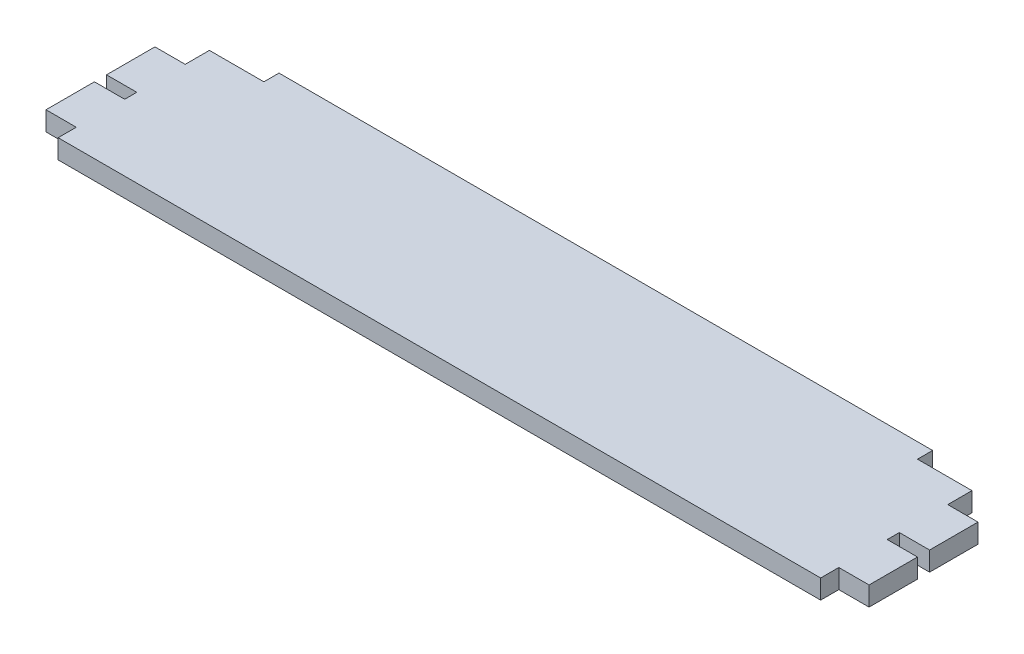
from build123d import *

# Parameters (mm, degrees)
SKETCH1_W               = 5
SKETCH1_H               = 18
SKETCH1_W_2             = 126
SKETCH1_H_2             = 24
SKETCH1_H_3             = 3.5
BOSS_EXTRUDE1_DEPTH     = 3.175
SKETCH2_W               = 9
SKETCH2_H               = 2.5
CUT_EXTRUDE1_DEPTH      = 70.81640656
CUT_EXTRUDE2_DEPTH      = 70.81640656
CUT_EXTRUDE2_DEPTH_BACK = 70.81640656
SKETCH5_W               = 5
SKETCH5_H               = 2


with BuildPart() as part:
    # Sketch1 → Boss-Extrude1 (new body)
    with BuildSketch(Plane(origin=(0, 0, 0), x_dir=(1, 0, 0), z_dir=(0, 1, 0))):
        with Locations((-65.5, 0)):
            Rectangle(SKETCH1_W, SKETCH1_H)
        Rectangle(SKETCH1_W_2, SKETCH1_H_2)
        with Locations((65.5, 0)):
            Rectangle(SKETCH1_W, SKETCH1_H)
        with Locations((0, 13.75)):
            Rectangle(SKETCH1_W_2, SKETCH1_H_3)
    extrude(amount=BOSS_EXTRUDE1_DEPTH)

    # Sketch2 → Cut-Extrude1 (cut, through all)
    with BuildSketch(Plane(origin=(0, 3.175, 0), x_dir=(1, 0, 0), z_dir=(0, 1, 0))):
        with Locations((-58.5, 14.25)):
            Rectangle(SKETCH2_W, SKETCH2_H)
        with Locations((58.5, 14.25)):
            Rectangle(SKETCH2_W, SKETCH2_H)
    extrude(amount=-CUT_EXTRUDE1_DEPTH, mode=Mode.SUBTRACT)

    # Sketch5 → Cut-Extrude2 (cut, two sides: drawn at the far end of the back side and taken through both)
    with BuildSketch(Plane(origin=(0, 3.175, 0), x_dir=(1, 0, 0), z_dir=(0, 1, 0)).offset(-CUT_EXTRUDE2_DEPTH_BACK)):
        with Locations((-65.5, 0)):
            Rectangle(SKETCH5_W, SKETCH5_H)
        with Locations((65.5, 0)):
            Rectangle(SKETCH5_W, SKETCH5_H)
    extrude(amount=CUT_EXTRUDE2_DEPTH + CUT_EXTRUDE2_DEPTH_BACK, mode=Mode.SUBTRACT)


solid = part.part
